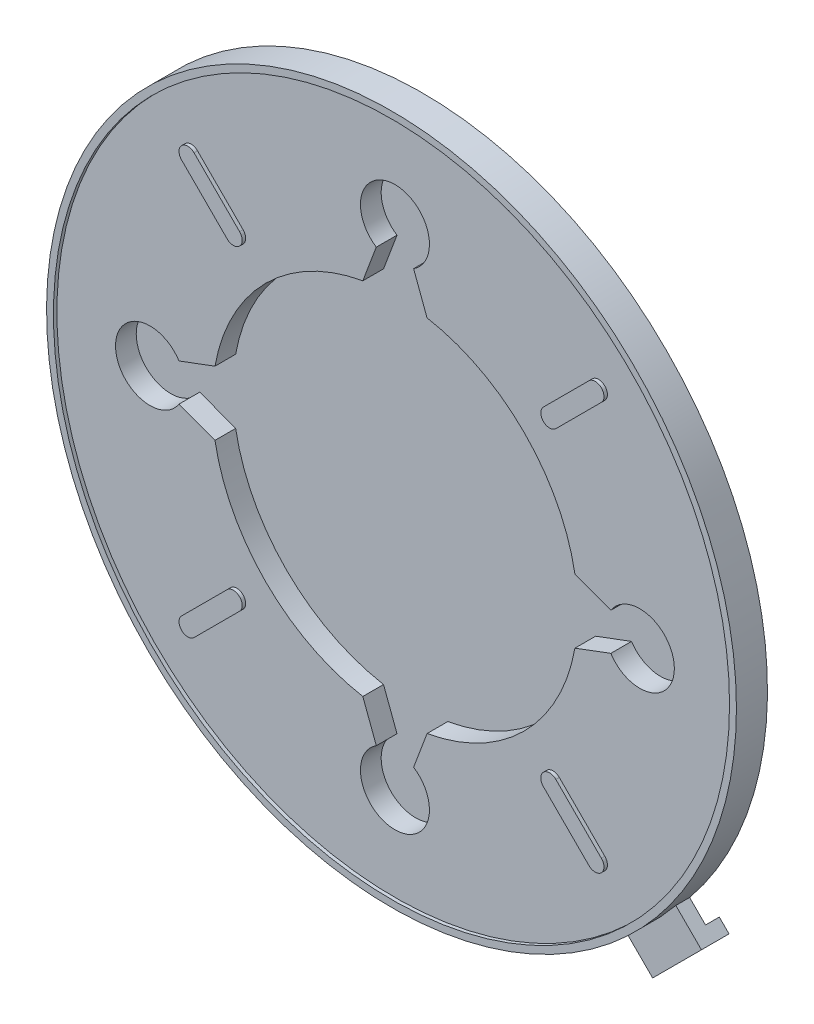
from build123d import *

# Parameters (mm, degrees)
CROQUIS2_R              = 50
SALIENTE_EXTRUIR2_DEPTH = 3
SALIENTE_EXTRUIR3_START = 1
CROQUIS3_R              = 50
SALIENTE_EXTRUIR3_DEPTH = 1
CROQUIS4_R              = 18
SALIENTE_EXTRUIR4_DEPTH = 6
CROQUIS5_R              = 50
CROQUIS5_R_2            = 49
SALIENTE_EXTRUIR5_DEPTH = 0.5
SALIENTE_EXTRUIR6_DEPTH = 2
SALIENTE_EXTRUIR7_DEPTH = 2


with BuildPart() as part:
    # Croquis2 → Saliente-Extruir2 (new body)
    with BuildSketch(Plane(origin=(0, 0, -5), x_dir=(-1, 0, 0), z_dir=(0, 0, -1))):
        Circle(CROQUIS2_R)
        with BuildLine():
            Line((-26.088038734, 4.654485475), (-31.293290297, 2.702516138))
            ThreePointArc((-31.293290297, 2.702516138), (-40.5, 0), (-31.293290297, -2.702516138))
            Line((-31.293290297, -2.702516138), (-26.088038734, -4.654485475))
            ThreePointArc((-26.088038734, -4.654485475), (-18.738329701, -18.738329701), (-4.654485475, -26.088038734))
            Line((-4.654485475, -26.088038734), (-2.702516138, -31.293290297))
            ThreePointArc((-2.702516138, -31.293290297), (0, -40.5), (2.702516138, -31.293290297))
            Line((2.702516138, -31.293290297), (4.654485475, -26.088038734))
            ThreePointArc((4.654485475, -26.088038734), (18.738329701, -18.738329701), (26.088038734, -4.654485475))
            Line((26.088038734, -4.654485475), (31.293290297, -2.702516138))
            ThreePointArc((31.293290297, -2.702516138), (40.5, 0), (31.293290297, 2.702516138))
            Line((31.293290297, 2.702516138), (26.088038734, 4.654485475))
            ThreePointArc((26.088038734, 4.654485475), (18.738329701, 18.738329701), (4.654485475, 26.088038734))
            Line((4.654485475, 26.088038734), (2.702516138, 31.293290297))
            ThreePointArc((2.702516138, 31.293290297), (0, 40.5), (-2.702516138, 31.293290297))
            Line((-2.702516138, 31.293290297), (-4.654485475, 26.088038734))
            ThreePointArc((-4.654485475, 26.088038734), (-18.738329701, 18.738329701), (-26.088038734, 4.654485475))
        make_face(mode=Mode.SUBTRACT)
    extrude(amount=-SALIENTE_EXTRUIR2_DEPTH)

    # Croquis3 → Saliente-Extruir3 (add)
    with BuildSketch(Plane(origin=(0, 0, -5), x_dir=(-1, 0, 0), z_dir=(0, 0, -1)).offset(SALIENTE_EXTRUIR3_START)):
        Circle(CROQUIS3_R)
    extrude(amount=-SALIENTE_EXTRUIR3_DEPTH)

    # Croquis4 → Saliente-Extruir4 (add)
    with BuildSketch(Plane(origin=(0, 0, -6), x_dir=(-1, 0, 0), z_dir=(0, 0, -1))):
        Circle(CROQUIS4_R)
    extrude(amount=SALIENTE_EXTRUIR4_DEPTH)

    # Croquis5 → Saliente-Extruir5 (add)
    # profile 1 of 5: a face of its own
    with BuildSketch(Plane.XY.offset(-2)):
        with Locations(Location((0, 0, 0), (0, 0, 180))):
            Circle(CROQUIS5_R)
        Circle(CROQUIS5_R_2, mode=Mode.SUBTRACT)
    # profile 2 of 5: a face of its own
    with BuildSketch(Plane.XY.offset(-2)):
        with BuildLine():
            Line((-30.425241187, 28.617399842), (-23.823505496, 22.01566415))
            ThreePointArc((-23.823505496, 22.01566415), (-22.01566415, 22.01566415), (-22.01566415, 23.823505496))
            Line((-22.01566415, 23.823505496), (-28.617399842, 30.425241187))
            ThreePointArc((-28.617399842, 30.425241187), (-30.425241187, 30.425241187), (-30.425241187, 28.617399842))
        make_face()
    # profile 3 of 5: a face of its own
    with BuildSketch(Plane.XY.offset(-2)):
        with BuildLine():
            Line((30.425241187, -28.617399842), (23.823505496, -22.01566415))
            ThreePointArc((23.823505496, -22.01566415), (22.01566415, -22.01566415), (22.01566415, -23.823505496))
            Line((22.01566415, -23.823505496), (28.617399842, -30.425241187))
            ThreePointArc((28.617399842, -30.425241187), (30.425241187, -30.425241187), (30.425241187, -28.617399842))
        make_face()
    # profile 4 of 5: a face of its own
    with BuildSketch(Plane.XY.offset(-2)):
        with BuildLine():
            Line((-28.617399842, -30.425241187), (-22.01566415, -23.823505496))
            ThreePointArc((-22.01566415, -23.823505496), (-22.01566415, -22.01566415), (-23.823505496, -22.01566415))
            Line((-23.823505496, -22.01566415), (-30.425241187, -28.617399842))
            ThreePointArc((-30.425241187, -28.617399842), (-30.425241187, -30.425241187), (-28.617399842, -30.425241187))
        make_face()
    # profile 5 of 5: a face of its own
    with BuildSketch(Plane.XY.offset(-2)):
        with BuildLine():
            Line((28.617399842, 30.425241187), (22.01566415, 23.823505496))
            ThreePointArc((22.01566415, 23.823505496), (22.01566415, 22.01566415), (23.823505496, 22.01566415))
            Line((23.823505496, 22.01566415), (30.425241187, 28.617399842))
            ThreePointArc((30.425241187, 28.617399842), (30.425241187, 30.425241187), (28.617399842, 30.425241187))
        make_face()
    extrude(amount=SALIENTE_EXTRUIR5_DEPTH)

    # Croquis6 → Saliente-Extruir6 (add)
    with BuildSketch(Plane(origin=(0, 0, -6), x_dir=(-1, 0, 0), z_dir=(0, 0, -1))):
        Polygon((-30.318233872, -37.389301684), (-35.355339059, -42.426406871), (-42.426406871, -35.355339059), (-38.890872965, -31.819805153), (-37.389301684, -30.318233872), align=None)
    extrude(amount=-SALIENTE_EXTRUIR6_DEPTH)

    # Croquis7 → Saliente-Extruir7 (add)
    with BuildSketch(Plane(origin=(0, 0, -6), x_dir=(-1, 0, 0), z_dir=(0, 0, -1))):
        Polygon((-42.426406871, -35.355339059), (-41.014653165, -33.943585354), (-33.943585354, -41.014653165), (-35.355339059, -42.426406871), align=None)
    extrude(amount=SALIENTE_EXTRUIR7_DEPTH)


solid = part.part
